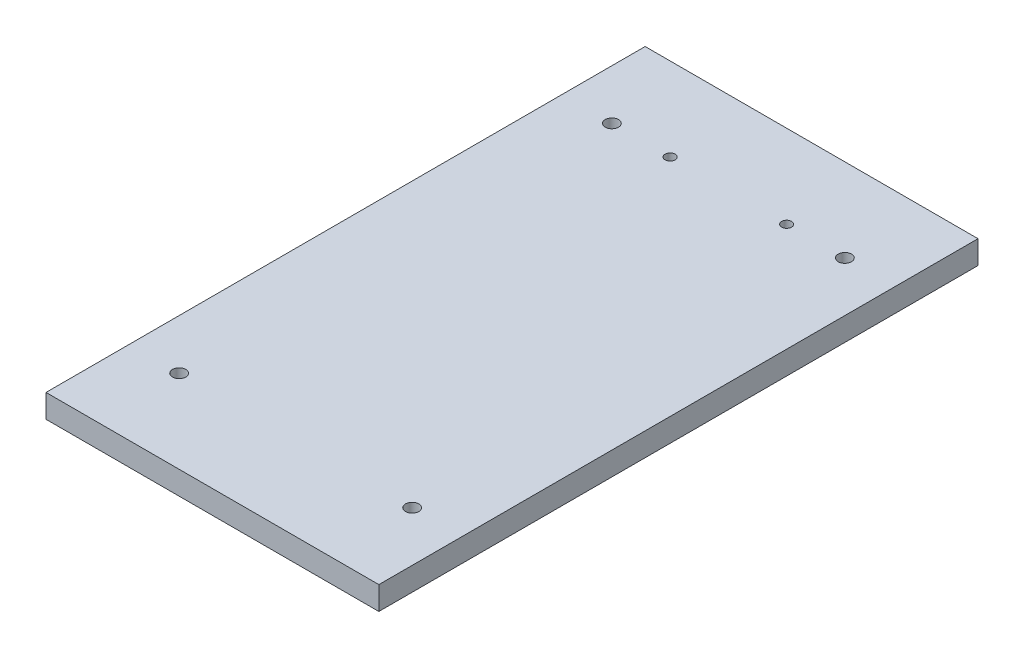
from build123d import *

# Parameters (mm, degrees)
SKETCH1_W           = 100
SKETCH1_H           = 180
BOSS_EXTRUDE1_DEPTH = 7
SKETCH3_R           = 2
CUT_EXTRUDE1_DEPTH  = 207.031550982
SKETCH4_R           = 1.5
CUT_EXTRUDE2_DEPTH  = 207.031550982


with BuildPart() as part:
    # Sketch1 → Boss-Extrude1 (new body)
    with BuildSketch(Plane(origin=(0, 0, 0), x_dir=(1, 0, 0), z_dir=(0, 1, 0))):
        with Locations((50, 90)):
            Rectangle(SKETCH1_W, SKETCH1_H)
    extrude(amount=BOSS_EXTRUDE1_DEPTH)

    # Sketch3 → Cut-Extrude1 (cut, through all)
    with BuildSketch(Plane(origin=(0, 7, 0), x_dir=(1, 0, 0), z_dir=(0, 1, 0))):
        with Locations(Location((15, 25, 0), (0, 0, 270))):
            Circle(SKETCH3_R)
        with Locations(Location((85, 25, 0), (0, 0, 270))):
            Circle(SKETCH3_R)
        with Locations(Location((15, 155, 0), (0, 0, 270))):
            Circle(SKETCH3_R)
        with Locations(Location((85, 155, 0), (0, 0, 270))):
            Circle(SKETCH3_R)
    extrude(amount=-CUT_EXTRUDE1_DEPTH, mode=Mode.SUBTRACT)

    # Sketch4 → Cut-Extrude2 (cut, through all)
    with BuildSketch(Plane(origin=(0, 7, 0), x_dir=(1, 0, 0), z_dir=(0, 1, 0))):
        with Locations(Location((32.5, 155, 0), (0, 0, 270))):
            Circle(SKETCH4_R)
        with Locations(Location((67.5, 155, 0), (0, 0, 270))):
            Circle(SKETCH4_R)
    extrude(amount=-CUT_EXTRUDE2_DEPTH, mode=Mode.SUBTRACT)


solid = part.part
